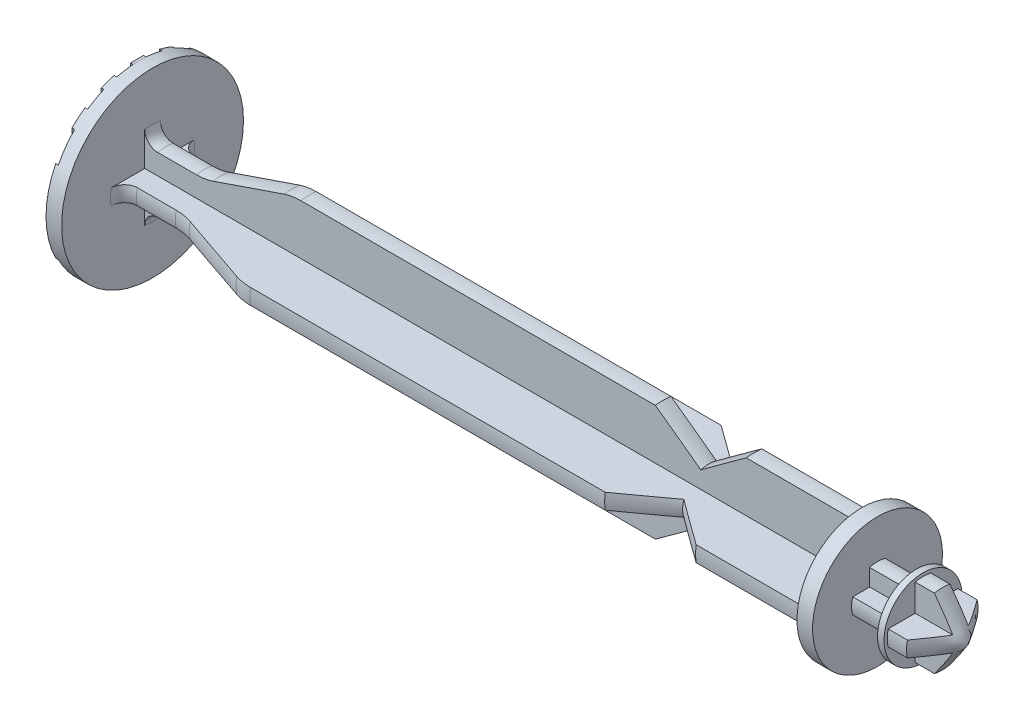
from build123d import *

# Parameters (mm, degrees)
SKETCH2_OUTSIDE_W   = 29.398
SKETCH2_OUTSIDE_H   = 29.398
CUT_EXTRUDE1_DEPTH  = 54.6
SKETCH3_OUTSIDE_W   = 29.398
SKETCH3_OUTSIDE_H   = 29.398
SKETCH3_OUTSIDE_W_2 = 1
SKETCH3_OUTSIDE_H_2 = 13.964240044
CUT_EXTRUDE2_DEPTH  = 0.2
SKETCH4_OUTSIDE_W   = 29.398
SKETCH4_OUTSIDE_H   = 29.398
CUT_EXTRUDE3_DEPTH  = 3
SKETCH5_OUTSIDE_W   = 29.398
SKETCH5_OUTSIDE_H   = 29.398
CUT_EXTRUDE4_DEPTH  = 3.5


with BuildPart() as part:
    # Sketch1 → Revolve1 (revolve)
    with BuildSketch(Plane.XY, mode=Mode.PRIVATE) as revolve1_sk:
        with BuildLine():
            Line((0, 0), (0, 7))
            Line((0, 7), (1.2, 7))
            Line((1.2, 7), (1.2, 3.25))
            ThreePointArc((1.2, 3.25), (1.492893219, 2.542893219), (2.2, 2.25))
            Line((2.2, 2.25), (5.2, 2.25))
            ThreePointArc((5.2, 2.25), (5.845954272, 2.302501668), (6.474951706, 2.458628461))
            Line((6.474951706, 2.458628461), (11.925048294, 4.291371539))
            ThreePointArc((11.925048294, 4.291371539), (12.554045728, 4.447498332), (13.2, 4.5))
            Line((13.2, 4.5), (40.5, 4.5))
            Line((40.5, 4.5), (44, 2))
            Line((44, 2), (47.5, 4.5))
            Line((47.5, 4.5), (55.8, 4.5))
            Line((55.8, 4.5), (55.8, 5))
            Line((55.8, 5), (57, 5))
            Line((57, 5), (57, 2))
            Line((57, 2), (60, 2))
            Line((60, 2), (60, 3))
            Line((60, 3), (61.8, 3))
            Line((61.8, 3), (64, 0))
            Line((64, 0), (0, 0))
        make_face()
    revolve(revolve1_sk.sketch.rotate(Axis((64, 0, 0), (-1, 0, 0)), 90), axis=Axis((64, 0, 0), (-1, 0, 0)))

    # Sketch2 outside → Cut-Extrude1 (cut)
    with BuildSketch(Plane(origin=(1.2, 0, 0), x_dir=(0, 0, -1), z_dir=(1, 0, 0))):
        Rectangle(SKETCH2_OUTSIDE_W, SKETCH2_OUTSIDE_H)
        with BuildLine():
            Line((-0.6, 6.97423831), (-0.6, 0.6))
            Line((-0.6, 0.6), (-6.97423831, 0.6))
            ThreePointArc((-6.97423831, 0.6), (-7, 0), (-6.97423831, -0.6))
            Line((-6.97423831, -0.6), (-0.6, -0.6))
            Line((-0.6, -0.6), (-0.6, -6.97423831))
            ThreePointArc((-0.6, -6.97423831), (0, -7), (0.6, -6.97423831))
            Line((0.6, -6.97423831), (0.6, -0.6))
            Line((0.6, -0.6), (6.97423831, -0.6))
            ThreePointArc((6.97423831, -0.6), (7, 0), (6.97423831, 0.6))
            Line((6.97423831, 0.6), (0.6, 0.6))
            Line((0.6, 0.6), (0.6, 6.97423831))
            ThreePointArc((0.6, 6.97423831), (0, 7), (-0.6, 6.97423831))
        make_face(mode=Mode.SUBTRACT)
    extrude(amount=CUT_EXTRUDE1_DEPTH, mode=Mode.SUBTRACT)

    # Sketch3 outside → Cut-Extrude2 (cut)
    with BuildSketch(Plane.ZY):
        Rectangle(SKETCH3_OUTSIDE_W, SKETCH3_OUTSIDE_H)
        with Locations((2.25, 0)):
            Rectangle(SKETCH3_OUTSIDE_W_2, SKETCH3_OUTSIDE_H_2, mode=Mode.SUBTRACT)
        Rectangle(SKETCH3_OUTSIDE_W_2, SKETCH3_OUTSIDE_H_2, mode=Mode.SUBTRACT)
        with Locations((4.5, 0)):
            Rectangle(SKETCH3_OUTSIDE_W_2, SKETCH3_OUTSIDE_H_2, mode=Mode.SUBTRACT)
        with Locations((6.75, 0)):
            Rectangle(SKETCH3_OUTSIDE_W_2, SKETCH3_OUTSIDE_H_2, mode=Mode.SUBTRACT)
        with Locations((9, 0)):
            Rectangle(SKETCH3_OUTSIDE_W_2, SKETCH3_OUTSIDE_H_2, mode=Mode.SUBTRACT)
        with Locations((11.25, 0)):
            Rectangle(SKETCH3_OUTSIDE_W_2, SKETCH3_OUTSIDE_H_2, mode=Mode.SUBTRACT)
        with Locations((13.5, 0)):
            Rectangle(SKETCH3_OUTSIDE_W_2, SKETCH3_OUTSIDE_H_2, mode=Mode.SUBTRACT)
        with Locations((-2.25, 0)):
            Rectangle(SKETCH3_OUTSIDE_W_2, SKETCH3_OUTSIDE_H_2, mode=Mode.SUBTRACT)
        with Locations((-4.5, 0)):
            Rectangle(SKETCH3_OUTSIDE_W_2, SKETCH3_OUTSIDE_H_2, mode=Mode.SUBTRACT)
        with Locations((-6.75, 0)):
            Rectangle(SKETCH3_OUTSIDE_W_2, SKETCH3_OUTSIDE_H_2, mode=Mode.SUBTRACT)
        with Locations((-9, 0)):
            Rectangle(SKETCH3_OUTSIDE_W_2, SKETCH3_OUTSIDE_H_2, mode=Mode.SUBTRACT)
        with Locations((-11.25, 0)):
            Rectangle(SKETCH3_OUTSIDE_W_2, SKETCH3_OUTSIDE_H_2, mode=Mode.SUBTRACT)
        with Locations((-13.5, 0)):
            Rectangle(SKETCH3_OUTSIDE_W_2, SKETCH3_OUTSIDE_H_2, mode=Mode.SUBTRACT)
    extrude(amount=-CUT_EXTRUDE2_DEPTH, mode=Mode.SUBTRACT)

    # Sketch4 outside → Cut-Extrude3 (cut)
    with BuildSketch(Plane(origin=(57, 0, 0), x_dir=(0, 0, -1), z_dir=(1, 0, 0))):
        Rectangle(SKETCH4_OUTSIDE_W, SKETCH4_OUTSIDE_H)
        with BuildLine():
            Line((0.6, 0.6), (0.6, 6.97423831))
            ThreePointArc((0.6, 6.97423831), (0, 7), (-0.6, 6.97423831))
            Line((-0.6, 6.97423831), (-0.6, 0.6))
            Line((-0.6, 0.6), (-6.97423831, 0.6))
            ThreePointArc((-6.97423831, 0.6), (-7, 0), (-6.97423831, -0.6))
            Line((-6.97423831, -0.6), (-0.6, -0.6))
            Line((-0.6, -0.6), (-0.6, -6.97423831))
            ThreePointArc((-0.6, -6.97423831), (0, -7), (0.6, -6.97423831))
            Line((0.6, -6.97423831), (0.6, -0.6))
            Line((0.6, -0.6), (6.97423831, -0.6))
            ThreePointArc((6.97423831, -0.6), (7, 0), (6.97423831, 0.6))
            Line((6.97423831, 0.6), (0.6, 0.6))
        make_face(mode=Mode.SUBTRACT)
    extrude(amount=CUT_EXTRUDE3_DEPTH, mode=Mode.SUBTRACT)

    # Sketch5 outside → Cut-Extrude4 (cut)
    with BuildSketch(Plane(origin=(64, 0, 0), x_dir=(0, 0, -1), z_dir=(1, 0, 0))):
        Rectangle(SKETCH5_OUTSIDE_W, SKETCH5_OUTSIDE_H)
        with BuildLine():
            Line((0.6, 0.6), (0.6, 2.68374738))
            ThreePointArc((0.6, 2.68374738), (0, 2.75), (-0.6, 2.68374738))
            Line((-0.6, 2.68374738), (-0.6, 0.6))
            Line((-0.6, 0.6), (-2.68374738, 0.6))
            ThreePointArc((-2.68374738, 0.6), (-2.75, 0), (-2.68374738, -0.6))
            Line((-2.68374738, -0.6), (-0.6, -0.6))
            Line((-0.6, -0.6), (-0.6, -2.68374738))
            ThreePointArc((-0.6, -2.68374738), (0, -2.75), (0.6, -2.68374738))
            Line((0.6, -2.68374738), (0.6, -0.6))
            Line((0.6, -0.6), (2.68374738, -0.6))
            ThreePointArc((2.68374738, -0.6), (2.75, 0), (2.68374738, 0.6))
            Line((2.68374738, 0.6), (0.6, 0.6))
        make_face(mode=Mode.SUBTRACT)
    extrude(amount=-CUT_EXTRUDE4_DEPTH, mode=Mode.SUBTRACT)


solid = part.part
